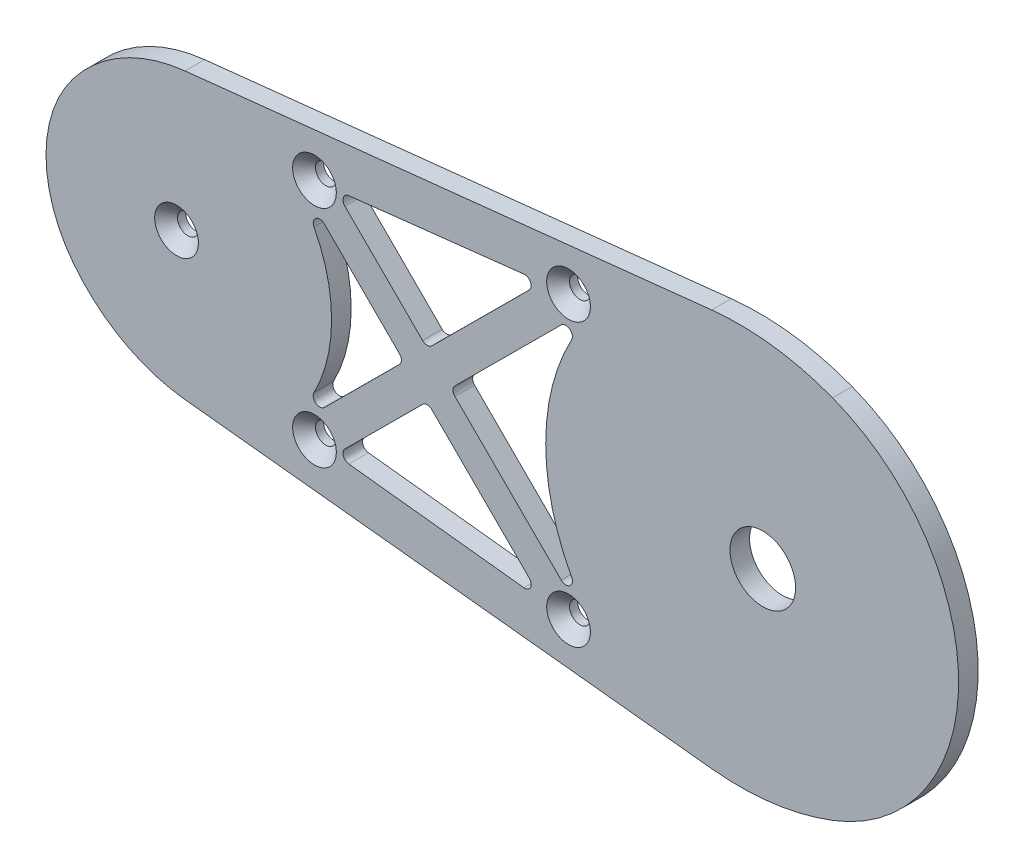
from build123d import *

# Parameters (mm, degrees)
SKETCH_1_R          = 1.6
SKETCH_1_R_2        = 5.025
EXTRUDE_1_DEPTH     = 3
SKETCH_2_R          = 1.6
CUT_EXTRUDE_1_DEPTH = 124.535581919
FILLET_1_R          = 1
EXTRUDE_START       = -3
EXTRUDE_2_DEPTH     = 3
CHAMFER_1_SIZE      = 1.75


with BuildPart() as part:
    # ｽｹｯﾁ1 → ﾎﾞｽ - 押し出し1 (new body)
    with BuildSketch(Plane.XY):
        with BuildLine():
            Line((-2.227171492, 19.875605831), (86.459242762, 29.813408746))
            ThreePointArc((86.459242762, 29.813408746), (119.8, 0), (86.459242762, -29.813408746))
            Line((86.459242762, -29.813408746), (-2.227171492, -19.875605831))
            ThreePointArc((-2.227171492, -19.875605831), (-20, 0), (-2.227171492, 19.875605831))
        make_face()
        Circle(SKETCH_1_R, mode=Mode.SUBTRACT)
        with Locations((89.8, 0)):
            Circle(SKETCH_1_R_2, mode=Mode.SUBTRACT)
    extrude(amount=EXTRUDE_1_DEPTH)

    # ｽｹｯﾁ2 → ｶｯﾄ - 押し出し1 (cut, through all)
    with BuildSketch(Plane.XY.offset(3)):
        with Locations((21.127828075, 17.209804787)):
            Circle(SKETCH_2_R)
        with Locations((21.127828075, -17.209804787)):
            Circle(SKETCH_2_R)
        with Locations((60.046685431, -21.570877871)):
            Circle(SKETCH_2_R)
        with Locations((60.046685431, 21.570877871)):
            Circle(SKETCH_2_R)
        Polygon((24.311632117, -17.566567628), (56.056085363, -21.123709076), (38.398951009, -3.529263334), align=None)
        Polygon((24.311632117, 17.566567628), (56.056085363, 21.123709076), (38.398951009, 3.529263334), align=None)
        with BuildLine():
            Line((34.857112989, 0), (22.640031329, -12.173707016))
            ThreePointArc((22.640031329, -12.173707016), (21.34147622, -12.270762122), (21.047953505, -11.002097675))
            ThreePointArc((21.047953505, -11.002097675), (23.75, 0), (21.047953505, 11.002097675))
            ThreePointArc((21.047953505, 11.002097675), (21.34147622, 12.270762122), (22.640031329, 12.173707016))
            Line((22.640031329, 12.173707016), (34.857112989, 0))
        make_face()
        with BuildLine():
            Line((58.927113914, 16.926017866), (41.940789029, 0))
            Line((41.940789029, 0), (58.927113914, -16.926017866))
            ThreePointArc((58.927113914, -16.926017866), (60.230336409, -17.019617306), (60.513751544, -15.744146574))
            ThreePointArc((60.513751544, -15.744146574), (56.55, 0), (60.513751544, 15.744146574))
            ThreePointArc((60.513751544, 15.744146574), (60.230336409, 17.019617306), (58.927113914, 16.926017866))
        make_face()
    extrude(amount=-CUT_EXTRUDE_1_DEPTH, mode=Mode.SUBTRACT)

    # ﾌｨﾚｯﾄ1
    fillet_1_edges = [part.edges().sort_by_distance(p)[0] for p in [
        (41.940789029, 0, 1.5),
        (56.056085363, 21.123709076, 1.5),
        (38.398951009, 3.529263334, 1.5),
        (24.311632117, 17.566567628, 1.5),
        (34.857112989, 0, 1.5),
        (38.398951009, -3.529263334, 1.5),
        (56.056085363, -21.123709076, 1.5),
        (24.311632117, -17.566567628, 1.5),
    ]]
    fillet(fillet_1_edges, radius=FILLET_1_R)

    # ｽｹｯﾁ3 → ﾎﾞｽ - 押し出し2 (add)
    with BuildSketch(Plane.XY.offset(3).offset(EXTRUDE_START)):
        with BuildLine():
            Line((1.298294376, 21.801707083), (81.979371475, 30.430868694))
            ThreePointArc((81.979371475, 30.430868694), (91.382052123, 30.32494875), (100.500192923, 28.026877661))
            ThreePointArc((100.500192923, 28.026877661), (93.586587742, 29.760069779), (86.459242762, 29.813408746))
            Line((86.459242762, 29.813408746), (-2.227171492, 19.875605831))
            ThreePointArc((-2.227171492, 19.875605831), (-9.804357498, 17.431998567), (-15.827921381, 12.226074789))
            ThreePointArc((-15.827921381, 12.226074789), (-8.243504916, 18.764300705), (1.298294376, 21.801707083))
        make_face()
        with BuildLine():
            Line((1.298294376, -21.801707083), (81.979371475, -30.430868694))
            ThreePointArc((81.979371475, -30.430868694), (91.382052123, -30.32494875), (100.500192923, -28.026877661))
            ThreePointArc((100.500192923, -28.026877661), (93.586587742, -29.760069779), (86.459242762, -29.813408746))
            Line((86.459242762, -29.813408746), (-2.227171492, -19.875605831))
            ThreePointArc((-2.227171492, -19.875605831), (-9.804357498, -17.431998567), (-15.827921381, -12.226074789))
            ThreePointArc((-15.827921381, -12.226074789), (-8.243504916, -18.764300705), (1.298294376, -21.801707083))
        make_face()
    extrude(amount=EXTRUDE_2_DEPTH)

    # 面取り1
    chamfer_1_edges = [part.edges().sort_by_distance(p)[0] for p in [
        (-1.6, 0, 3),
        (19.527828075, 17.209804787, 3),
        (58.446685431, 21.570877871, 3),
        (58.446685431, -21.570877871, 3),
        (19.527828075, -17.209804787, 3),
    ]]
    chamfer(chamfer_1_edges, length=CHAMFER_1_SIZE)


solid = part.part
